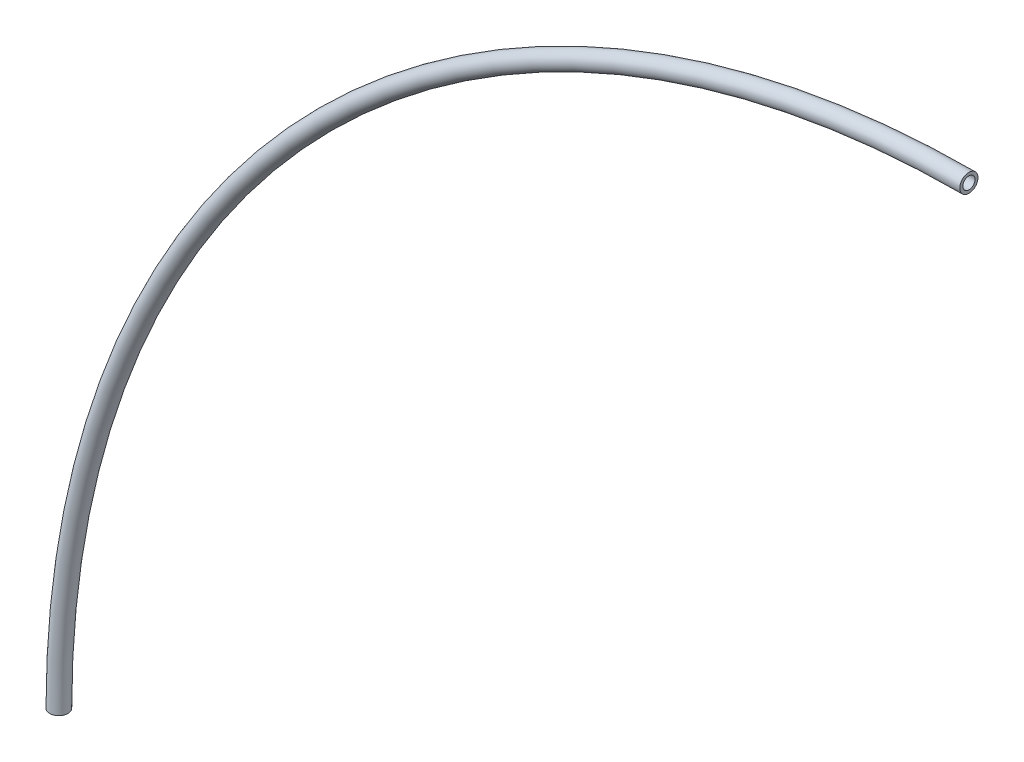
from build123d import *

# Parameters (mm, degrees)
SWEEP_1_PROFILE_R   = 6
SWEEP_1_PROFILE_R_2 = 4


with BuildPart() as part:
    # 扫描-薄件1: sweep along a path in 草图1
    with BuildLine(Plane.XY) as sweep_1_path:
        ThreePointArc((-600, 0), (-424.264068712, 424.264068712), (0, 600))
    # 扫描-薄件1 profile (on start of the path) → 扫描-薄件1 (sweep)
    with BuildSketch(Plane(origin=(-600, 0, 0), x_dir=(1, 0, 0), z_dir=(0, 1, 0))):
        Circle(SWEEP_1_PROFILE_R)
        Circle(SWEEP_1_PROFILE_R_2, mode=Mode.SUBTRACT)
    sweep(path=sweep_1_path.line)


solid = part.part
